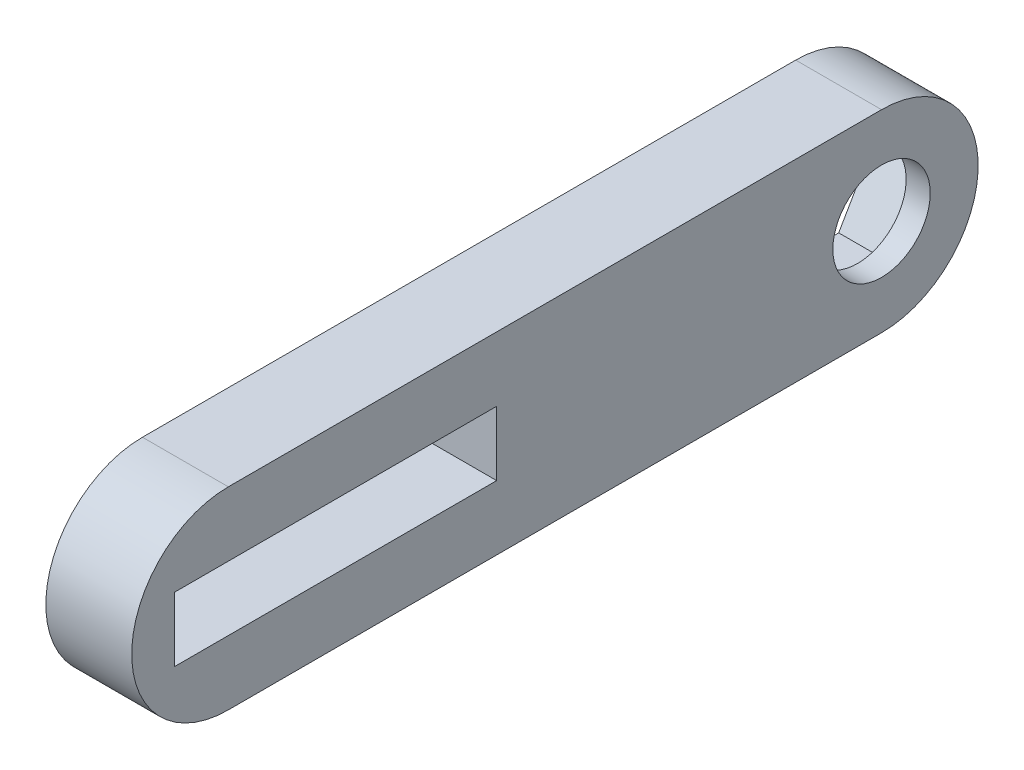
from build123d import *

# Parameters (mm, degrees)
BOSS_EXTRUDE1_DEPTH      = 3.175
M3_CLEARANCE_HOLE1_D     = 3.6
M3_CLEARANCE_HOLE1_DEPTH = 7.62
M3_CLEARANCE_HOLE1_TIP   = 1.081549114
SKETCH9_W                = 11.90625
SKETCH9_H                = 2.38125
CUT_EXTRUDE1_DEPTH       = 17.360887498
CUT_EXTRUDE2_DEPTH       = 2.286


with BuildPart() as part:
    # Sketch1 → Boss-Extrude1 (new body)
    with BuildSketch(Plane(origin=(0, 0, 0), x_dir=(0, 0, -1), z_dir=(1, 0, 0))):
        with BuildLine():
            Line((-12.075480167, 3.571875), (12.075480167, 3.571875))
            ThreePointArc((12.075480167, 3.571875), (15.647355167, 0), (12.075480167, -3.571875))
            Line((12.075480167, -3.571875), (-12.075480167, -3.571875))
            ThreePointArc((-12.075480167, -3.571875), (-15.647355167, 0), (-12.075480167, 3.571875))
        make_face()
    extrude(amount=BOSS_EXTRUDE1_DEPTH)

    # M3 Clearance Hole1
    with Locations(Plane.ZY):
        with Locations((-12.075480167, 0)):
            Hole(M3_CLEARANCE_HOLE1_D / 2, depth=M3_CLEARANCE_HOLE1_DEPTH)
            with Locations((0, 0, -(M3_CLEARANCE_HOLE1_DEPTH + M3_CLEARANCE_HOLE1_TIP / 2))):  # 118° drill point
                Cone(0, M3_CLEARANCE_HOLE1_D / 2, M3_CLEARANCE_HOLE1_TIP, mode=Mode.SUBTRACT)

    # Sketch9 → Cut-Extrude1 (cut, through all)
    with BuildSketch(Plane.ZY):
        with Locations((8.106730167, 0)):
            Rectangle(SKETCH9_W, SKETCH9_H)
    extrude(amount=-CUT_EXTRUDE1_DEPTH, mode=Mode.SUBTRACT)

    # Sketch10 → Cut-Extrude2 (cut)
    with BuildSketch(Plane.ZY):
        Polygon((-10.48436056, -2.7559), (-8.893240953, 0), (-10.48436056, 2.7559), (-13.666599774, 2.7559), (-15.257719381, 0), (-13.666599774, -2.7559), align=None)
    extrude(amount=-CUT_EXTRUDE2_DEPTH, mode=Mode.SUBTRACT)


solid = part.part
